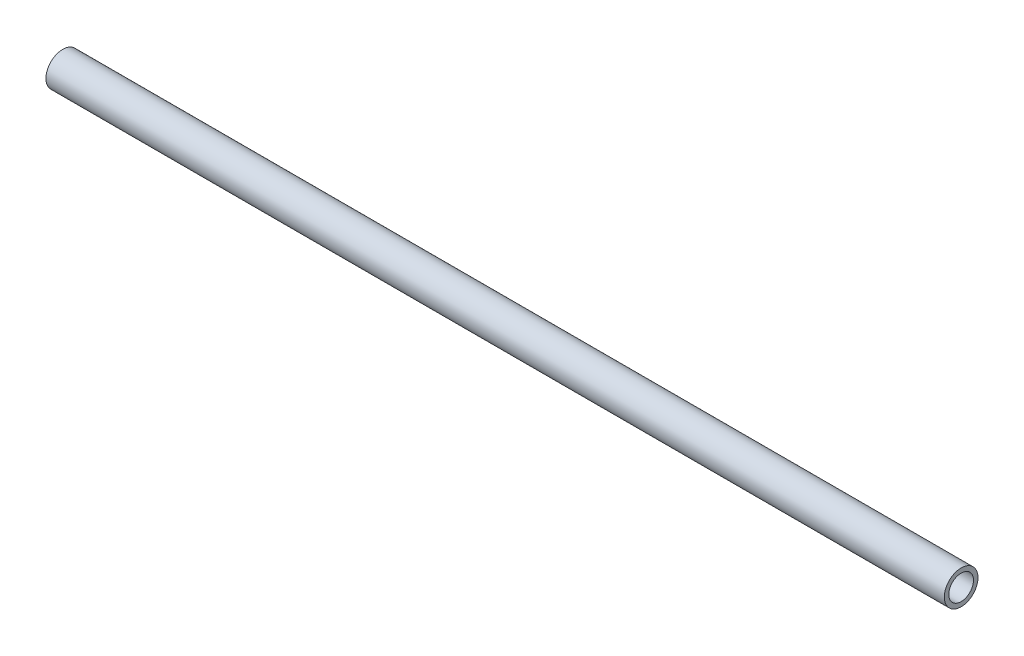
from build123d import *

# Parameters (mm, degrees)
SKETCH6_R   = 7.5
SKETCH6_R_2 = 5.5


with BuildPart() as part:
    # Sweep1: sweep along a path in Sketch5
    with BuildLine(Plane.XY) as sweep1_path:
        Line((-390.178402047, -2.510858626), (9.821597953, -2.510858626))
    # Sketch6 → Sweep1 (sweep)
    with BuildSketch(Plane(origin=(-390.178402047, 0, 0), x_dir=(0, 0, -1), z_dir=(1, 0, 0))):
        with Locations((0, -1.011000549)):
            Circle(SKETCH6_R)
        with Locations((0, -1.011000549)):
            Circle(SKETCH6_R_2, mode=Mode.SUBTRACT)
    sweep(path=sweep1_path.line)


solid = part.part
